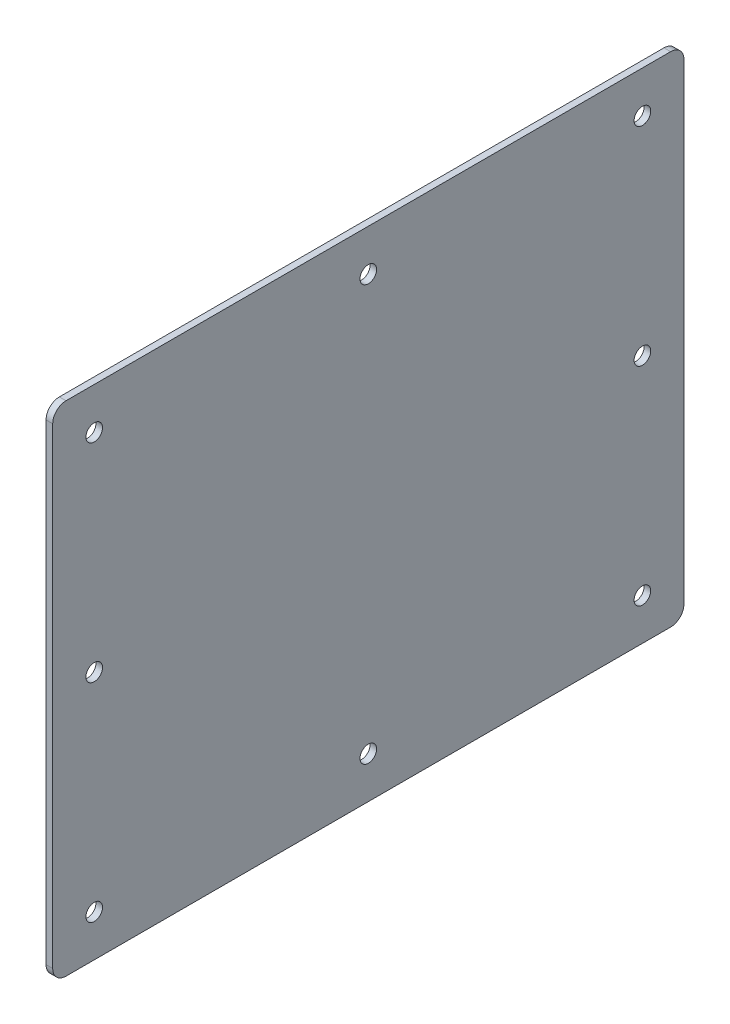
from build123d import *

# Parameters (mm, degrees)
SKETCH1_W               = 190.5
SKETCH1_H               = 241.3
BOSS_EXTRUDE1_DEPTH     = 2.54
FILLET1_R               = 5.08
CUT_EXTRUDE1_DEPTH      = 154.738208003
CUT_EXTRUDE1_DEPTH_BACK = 154.738208003
SKETCH2_R               = 3.175


with BuildPart() as part:
    # Sketch1 → Boss-Extrude1 (new body)
    with BuildSketch(Plane.YZ):
        Rectangle(SKETCH1_W, SKETCH1_H)
    extrude(amount=BOSS_EXTRUDE1_DEPTH)

    # Fillet1
    fillet1_edges = [part.edges().sort_by_distance(p)[0] for p in [
        (1.27, 95.25, -120.65),
        (1.27, -95.25, -120.65),
        (1.27, -95.25, 120.65),
        (1.27, 95.25, 120.65),
    ]]
    fillet(fillet1_edges, radius=FILLET1_R)

    # Sketch2 → Cut-Extrude1 (cut, two sides: drawn at the far end of the back side and taken through both)
    with BuildSketch(Plane(origin=(2.54, 0, 0), x_dir=(0, 0, -1), z_dir=(1, 0, 0)).offset(-CUT_EXTRUDE1_DEPTH_BACK)):
        with Locations((-574.675, 0)):
            Circle(SKETCH2_R)
        with Locations((-725.4875, 79.375)):
            Circle(SKETCH2_R)
        with Locations((-831.85, 79.375)):
            Circle(SKETCH2_R)
        with Locations((-938.2125, 79.375)):
            Circle(SKETCH2_R)
        with Locations((-1044.575, 79.375)):
            Circle(SKETCH2_R)
        with Locations((-1044.575, -79.375)):
            Circle(SKETCH2_R)
        with Locations((-1044.575, 0)):
            Circle(SKETCH2_R)
        with Locations((-574.675, 79.375)):
            Circle(SKETCH2_R)
        with Locations((-468.3125, 79.375)):
            Circle(SKETCH2_R)
        with Locations((-574.675, -79.375)):
            Circle(SKETCH2_R)
        with Locations((-725.4875, -79.375)):
            Circle(SKETCH2_R)
        with Locations((-619.125, -79.375)):
            Circle(SKETCH2_R)
        with Locations((-619.125, 0)):
            Circle(SKETCH2_R)
        with Locations((-619.125, 79.375)):
            Circle(SKETCH2_R)
        with Locations((-255.5875, 79.375)):
            Circle(SKETCH2_R)
        with Locations((-361.95, 79.375)):
            Circle(SKETCH2_R)
        with Locations((-938.2125, -79.375)):
            Circle(SKETCH2_R)
        with Locations((-831.85, -79.375)):
            Circle(SKETCH2_R)
        with Locations((-149.225, -79.375)):
            Circle(SKETCH2_R)
        with Locations((-255.5875, -79.375)):
            Circle(SKETCH2_R)
        with Locations((-149.225, 79.375)):
            Circle(SKETCH2_R)
        with Locations((-361.95, -79.375)):
            Circle(SKETCH2_R)
        with Locations((-149.225, 0)):
            Circle(SKETCH2_R)
        with Locations((-468.3125, -79.375)):
            Circle(SKETCH2_R)
        with Locations((0, 79.375)):
            Circle(SKETCH2_R)
        with Locations((0, -79.375)):
            Circle(SKETCH2_R)
        with Locations((-104.775, -79.375)):
            Circle(SKETCH2_R)
        with Locations((-104.775, 79.375)):
            Circle(SKETCH2_R)
        with Locations((104.775, 0)):
            Circle(SKETCH2_R)
        with Locations((-104.775, 0)):
            Circle(SKETCH2_R)
        with Locations((104.775, -79.375)):
            Circle(SKETCH2_R)
        with Locations((104.775, 79.375)):
            Circle(SKETCH2_R)
    extrude(amount=CUT_EXTRUDE1_DEPTH + CUT_EXTRUDE1_DEPTH_BACK, mode=Mode.SUBTRACT)


solid = part.part
